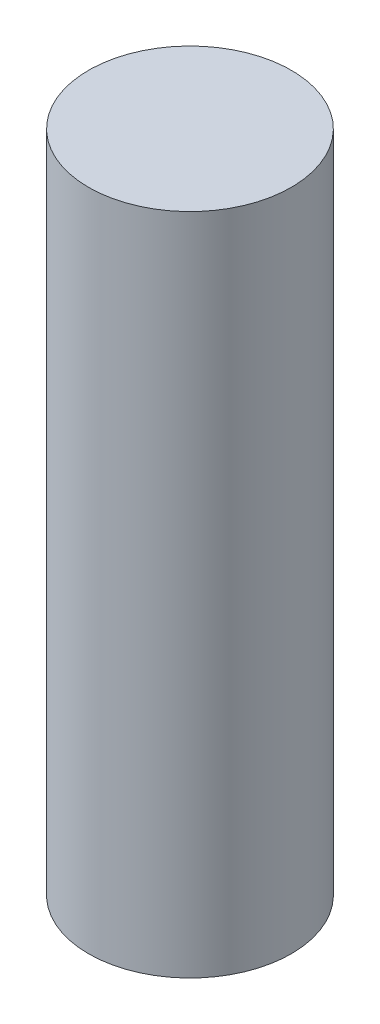
from build123d import *

# Parameters (mm, degrees)
SKETCH1_R           = 16.5
BOSS_EXTRUDE1_DEPTH = 108


with BuildPart() as part:
    # Sketch1 → Boss-Extrude1 (new body)
    with BuildSketch(Plane(origin=(0, 0, 0), x_dir=(1, 0, 0), z_dir=(0, 1, 0))):
        with Locations(Location((0, 0, 0), (0, 0, 270))):
            Circle(SKETCH1_R)
    extrude(amount=BOSS_EXTRUDE1_DEPTH)


solid = part.part
